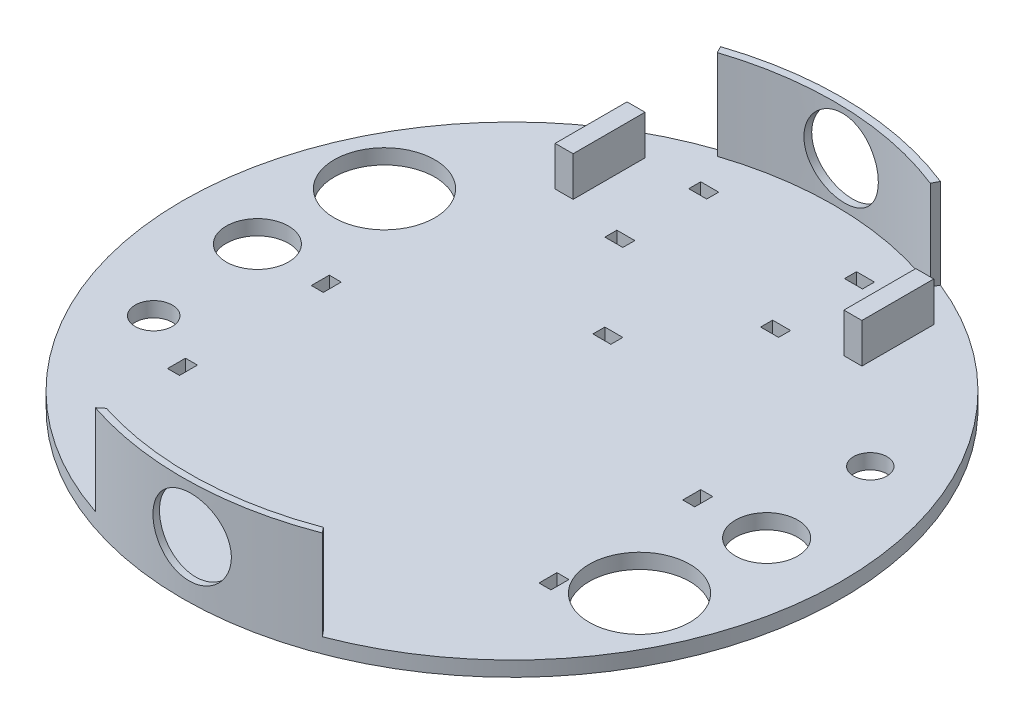
from build123d import *

# Parameters (mm, degrees)
SKETCH1_R           = 69.85
BOSS_EXTRUDE1_DEPTH = 3.175
SKETCH2_R           = 6.604
SKETCH2_R_2         = 3.937
SKETCH2_R_3         = 3.556
SKETCH2_R_4         = 10.668
CUT_EXTRUDE1_DEPTH  = 3.175
SKETCH3_W           = 3.81
SKETCH3_H           = 15.24
BOSS_EXTRUDE2_DEPTH = 8.382
SKETCH3_4_W         = 2.54
SKETCH3_4_H         = 3.81
SKETCH3_4_W_2       = 3.81
SKETCH3_4_H_2       = 2.54
CUT_EXTRUDE2_DEPTH  = 8.382
SKETCH4_W           = 3.81
SKETCH4_H           = 15.24
BOSS_EXTRUDE4_DEPTH = 8.382
BOSS_EXTRUDE5_DEPTH = 19.05
SKETCH6_R           = 8.128
CUT_EXTRUDE3_DEPTH  = 19.05
SKETCH7_R           = 8.128
CUT_EXTRUDE4_DEPTH  = 19.05


with BuildPart() as part:
    # Sketch1 → Boss-Extrude1 (new body)
    with BuildSketch(Plane(origin=(0, 0, 0), x_dir=(1, 0, 0), z_dir=(0, 1, 0))):
        with Locations(Location((0, 0, 0), (0, 0, 270))):
            Circle(SKETCH1_R)
    extrude(amount=BOSS_EXTRUDE1_DEPTH)

    # Sketch2 → Cut-Extrude1 (cut)
    with BuildSketch(Plane(origin=(0, 3.175, 0), x_dir=(1, 0, 0), z_dir=(0, 1, 0))):
        with Locations(Location((-53.975, 0, 0), (0, 0, 270))):
            Circle(SKETCH2_R)
        with Locations(Location((53.975, 0, 0), (0, 0, 270))):
            Circle(SKETCH2_R)
        with Locations(Location((-51.795490029, -24.152633658, 0), (0, 0, 270))):
            Circle(SKETCH2_R_2)
        with Locations(Location((51.795490029, 24.152633658, 0), (0, 0, 270))):
            Circle(SKETCH2_R_3)
        with Locations(Location((50.64447914, -23.615908466, 0), (0, 0, 270))):
            Circle(SKETCH2_R_4)
        with Locations(Location((-50.64447914, 23.615908466, 0), (0, 0, 270))):
            Circle(SKETCH2_R_4)
    extrude(amount=-CUT_EXTRUDE1_DEPTH, mode=Mode.SUBTRACT)

    # Sketch3 → Boss-Extrude2 (add)
    with BuildSketch(Plane(origin=(0, 3.175, 0), x_dir=(1, 0, 0), z_dir=(0, 1, 0))):
        with Locations((-30.607, 49.276)):
            Rectangle(SKETCH3_W, SKETCH3_H)
    extrude(amount=BOSS_EXTRUDE2_DEPTH)

    # Sketch3<4> → Cut-Extrude2 (cut)
    with BuildSketch(Plane(origin=(0, 3.175, 0), x_dir=(1, 0, 0), z_dir=(0, 1, 0))):
        with Locations((-39.37, 0)):
            Rectangle(SKETCH3_4_W, SKETCH3_4_H)
        with Locations((-39.37, -30.48)):
            Rectangle(SKETCH3_4_W, SKETCH3_4_H)
        with Locations((39.37, -30.48)):
            Rectangle(SKETCH3_4_W, SKETCH3_4_H)
        with Locations((39.37, 0)):
            Rectangle(SKETCH3_4_W, SKETCH3_4_H)
        with Locations((0, 20.32)):
            Rectangle(SKETCH3_4_W_2, SKETCH3_4_H_2)
        with Locations((0, -50.8)):
            Rectangle(SKETCH3_4_W_2, SKETCH3_4_H_2)
        with Locations((-16.51, 57.15)):
            Rectangle(SKETCH3_4_W_2, SKETCH3_4_H_2)
        with Locations((16.51, 57.15)):
            Rectangle(SKETCH3_4_W_2, SKETCH3_4_H_2)
        with Locations((16.51, 39.37)):
            Rectangle(SKETCH3_4_W_2, SKETCH3_4_H_2)
        with Locations((-16.51, 39.37)):
            Rectangle(SKETCH3_4_W_2, SKETCH3_4_H_2)
    extrude(amount=-CUT_EXTRUDE2_DEPTH, mode=Mode.SUBTRACT)

    # Sketch4 → Boss-Extrude4 (add)
    with BuildSketch(Plane(origin=(0, 3.175, 0), x_dir=(1, 0, 0), z_dir=(0, 1, 0))):
        with Locations((30.607, 49.276)):
            Rectangle(SKETCH4_W, SKETCH4_H)
    extrude(amount=BOSS_EXTRUDE4_DEPTH)

    # Sketch5 → Boss-Extrude5 (add)
    with BuildSketch(Plane(origin=(0, 3.175, 0), x_dir=(1, 0, 0), z_dir=(0, 1, 0))):
        with BuildLine():
            Line((-22.060225105, 66.27494978), (-21.331257294, 64.841108186))
            ThreePointArc((-21.331257294, 64.841108186), (2.077551681, 68.228114642), (25.236913051, 63.423103584))
            Line((25.236913051, 63.423103584), (25.974086879, 64.841108186))
            ThreePointArc((25.974086879, 64.841108186), (2.084119461, 69.818901066), (-22.060225105, 66.27494978))
        make_face()
        with BuildLine():
            Line((-22.060225105, -66.27494978), (-20.764940728, -65.218037135))
            ThreePointArc((-20.764940728, -65.218037135), (1.754255855, -68.421471174), (24.07970803, -64.068266657))
            Line((24.07970803, -64.068266657), (25.012599469, -65.218037135))
            ThreePointArc((25.012599469, -65.218037135), (1.567926874, -69.832400111), (-22.060225105, -66.27494978))
        make_face()
    extrude(amount=BOSS_EXTRUDE5_DEPTH)

    # Sketch6 → Cut-Extrude3 (cut)
    with BuildSketch(Plane(origin=(2.084119461, 22.225, -69.818901066), x_dir=(-0.9995547754627743, 0, -0.02983707173237782), z_dir=(0.029837071732377825, 0, -0.9995547754627744))):
        with Locations((0, -9.386828468)):
            Circle(SKETCH6_R)
    extrude(amount=-CUT_EXTRUDE3_DEPTH, mode=Mode.SUBTRACT)

    # Sketch7 → Cut-Extrude4 (cut)
    with BuildSketch(Plane(origin=(1.567926874, 22.225, 69.832400111), x_dir=(0.9997480330908115, 0, -0.022447056177901516), z_dir=(0.022447056177901513, 0, 0.9997480330908114))):
        with Locations((0, -10.16)):
            Circle(SKETCH7_R)
    extrude(amount=-CUT_EXTRUDE4_DEPTH, mode=Mode.SUBTRACT)


solid = part.part
